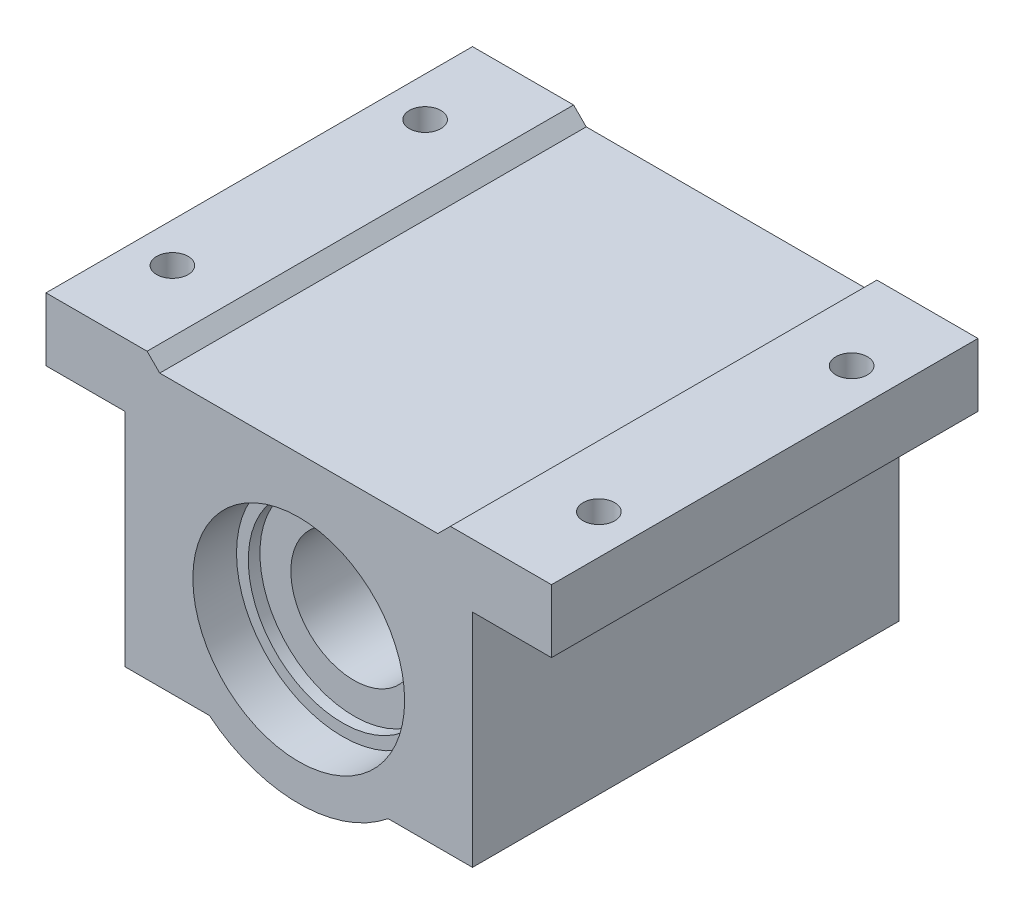
from build123d import *

# Parameters (mm, degrees)
SKETCH1_R            = 10.64133
MAIN_BODY_DEPTH      = 21.43125
SKETCH3_R            = 1.5875
MOUNTING_HOLES_DEPTH = 6.35
SKETCH8_R            = 10.64133
SKETCH8_R_2          = 6.35
INTERIOR_DEPTH       = 15.875
GROOVES_2_W          = 1.1684
GROOVES_2_H          = 2.36474
GROOVES_2_2_W        = 1.1684
GROOVES_2_2_H        = 2.36474


with BuildPart() as part:
    # Sketch1 → Main Body (new, symmetric)
    with BuildSketch(Plane.XY):
        with BuildLine():
            Line((-17.4625, 11.1125), (-25.4, 11.1125))
            Line((-25.4, 11.1125), (-25.4, 17.4625))
            Line((-25.4, 17.4625), (-15.24, 17.4625))
            Line((-15.24, 17.4625), (-13.97, 16.1925))
            Line((-13.97, 16.1925), (13.97, 16.1925))
            Line((13.97, 16.1925), (15.24, 17.4625))
            Line((15.24, 17.4625), (25.4, 17.4625))
            Line((25.4, 17.4625), (25.4, 11.1125))
            Line((25.4, 11.1125), (17.4625, 11.1125))
            Line((17.4625, 11.1125), (17.4625, -11.1125))
            Line((17.4625, -11.1125), (8.980256121, -11.1125))
            ThreePointArc((8.980256121, -11.1125), (0, -14.2875), (-8.980256121, -11.1125))
            Line((-8.980256121, -11.1125), (-17.4625, -11.1125))
            Line((-17.4625, -11.1125), (-17.4625, 11.1125))
        make_face()
        Circle(SKETCH1_R, mode=Mode.SUBTRACT)
    extrude(amount=MAIN_BODY_DEPTH, both=True)

    # Sketch3 → Mounting Holes (cut)
    with BuildSketch(Plane(origin=(0, 17.4625, 0), x_dir=(1, 0, 0), z_dir=(0, 1, 0))):
        with Locations(Location((-21.43125, 12.7, 0), (0, 0, 270))):
            Circle(SKETCH3_R)
        with Locations(Location((21.43125, 12.7, 0), (0, 0, 270))):
            Circle(SKETCH3_R)
        with Locations(Location((21.43125, -12.7, 0), (0, 0, 270))):
            Circle(SKETCH3_R)
        with Locations(Location((-21.43125, -12.7, 0), (0, 0, 270))):
            Circle(SKETCH3_R)
    extrude(amount=-MOUNTING_HOLES_DEPTH, mode=Mode.SUBTRACT)

    # Grooves 2 → Grooves (revolve, cut)
    with BuildSketch(Plane(origin=(0, 0, 0), x_dir=(0, 0, -1), z_dir=(1, 0, 0)), mode=Mode.PRIVATE) as grooves_sk:
        with Locations((16.4592, -10.64133)):
            Rectangle(GROOVES_2_W, GROOVES_2_H)
        with Locations((-16.4592, -10.64133)):
            Rectangle(GROOVES_2_W, GROOVES_2_H)
    revolve(grooves_sk.sketch.rotate(Axis((0, 0, 15.875), (0, 0, -1)), 270), axis=Axis((0, 0, 15.875), (0, 0, -1)), mode=Mode.SUBTRACT)


with BuildPart() as body_2:
    # Sketch8 → Interior (new, symmetric)
    with BuildSketch(Plane.XY):
        Circle(SKETCH8_R)
        Circle(SKETCH8_R_2, mode=Mode.SUBTRACT)
    extrude(amount=INTERIOR_DEPTH, both=True)


with BuildPart() as body_3:
    # Grooves_2 2 → Retaining Ring (revolve)
    with BuildSketch(Plane(origin=(0, 0, 0), x_dir=(0, 0, -1), z_dir=(1, 0, 0)), mode=Mode.PRIVATE) as retaining_ring_sk:
        with Locations((16.4592, -10.64133)):
            Rectangle(GROOVES_2_2_W, GROOVES_2_2_H)
        with Locations((-16.4592, -10.64133)):
            Rectangle(GROOVES_2_2_W, GROOVES_2_2_H)
    revolve(retaining_ring_sk.sketch.rotate(Axis((0, 0, 15.875), (0, 0, -1)), 270), axis=Axis((0, 0, 15.875), (0, 0, -1)))


solid = Compound([part.part, body_2.part, body_3.part])
